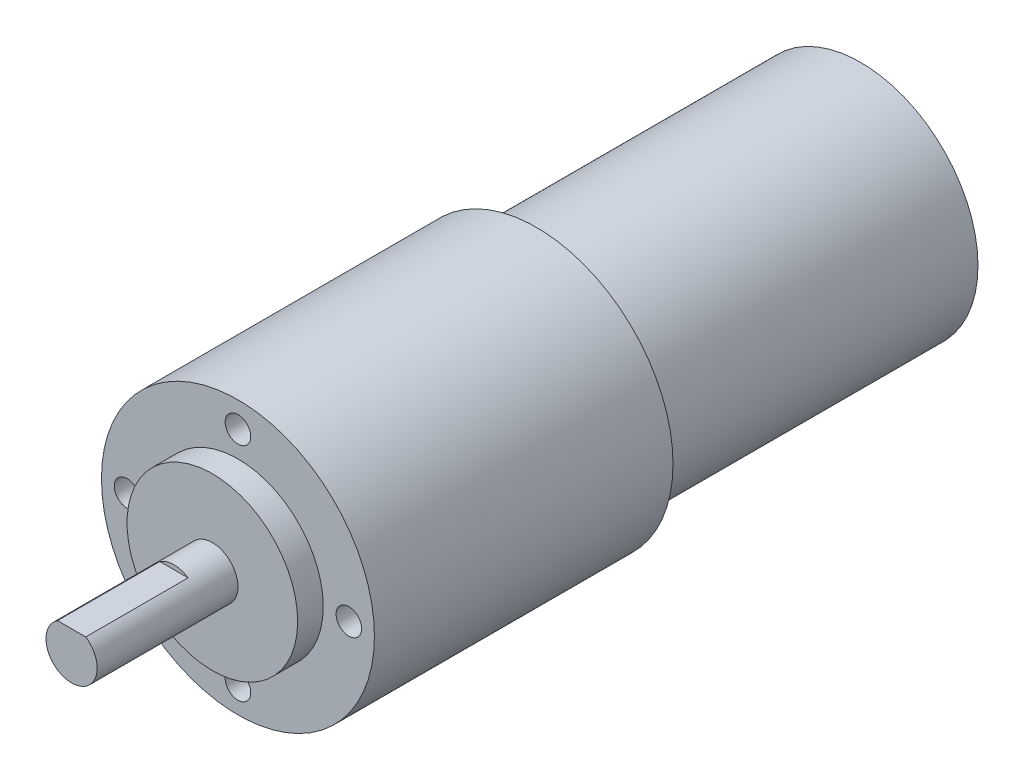
from build123d import *

# Parameters (mm, degrees)
SKETCH_1_R          = 16
EXTRUDE_1_DEPTH     = 35
SKETCH_2_R          = 10
EXTRUDE_2_DEPTH     = 3
SKETCH_3_R          = 3
EXTRUDE_3_DEPTH     = 16.5
CUT_EXTRUDE_START   = 3
SKETCH_4_W          = 9.243576196
SKETCH_4_H          = 12
CUT_EXTRUDE_1_DEPTH = 0.5
SKETCH_5_R          = 13.75
EXTRUDE_4_DEPTH     = 38
SKETCH_6_R          = 1.5
CUT_EXTRUDE_2_DEPTH = 5


with BuildPart() as part:
    # ｽｹｯﾁ1 → ﾎﾞｽ - 押し出し1 (new body)
    with BuildSketch(Plane.XY):
        Circle(SKETCH_1_R)
    extrude(amount=EXTRUDE_1_DEPTH)

    # ｽｹｯﾁ2 → ﾎﾞｽ - 押し出し2 (add)
    with BuildSketch(Plane.XY.offset(35)):
        Circle(SKETCH_2_R)
    extrude(amount=EXTRUDE_2_DEPTH)

    # ｽｹｯﾁ3 → ﾎﾞｽ - 押し出し3 (add)
    with BuildSketch(Plane.XY.offset(38)):
        Circle(SKETCH_3_R)
    extrude(amount=EXTRUDE_3_DEPTH)

    # ｽｹｯﾁ4 → ｶｯﾄ - 押し出し1 (cut)
    with BuildSketch(Plane(origin=(0, 0, 0), x_dir=(1, 0, 0), z_dir=(0, 1, 0)).offset(CUT_EXTRUDE_START)):
        with Locations((0, -48.5)):
            Rectangle(SKETCH_4_W, SKETCH_4_H)
    extrude(amount=-CUT_EXTRUDE_1_DEPTH, mode=Mode.SUBTRACT)

    # ｽｹｯﾁ5 → ﾎﾞｽ - 押し出し4 (add)
    with BuildSketch(Plane(origin=(0, 0, 0), x_dir=(-1, 0, 0), z_dir=(0, 0, -1))):
        with Locations(Location((0, 0, 0), (0, 0, 180))):
            Circle(SKETCH_5_R)
    extrude(amount=EXTRUDE_4_DEPTH)

    # ｽｹｯﾁ6 → ｶｯﾄ - 押し出し2 (cut)
    with BuildSketch(Plane.XY.offset(35)):
        with Locations((0, 13)):
            Circle(SKETCH_6_R)
        with Locations((-13, 0)):
            Circle(SKETCH_6_R)
        with Locations(Location((13, 0, 0), (0, 0, 180))):
            Circle(SKETCH_6_R)
        with Locations(Location((0, -13, 0), (0, 0, 180))):
            Circle(SKETCH_6_R)
    extrude(amount=-CUT_EXTRUDE_2_DEPTH, mode=Mode.SUBTRACT)


solid = part.part
